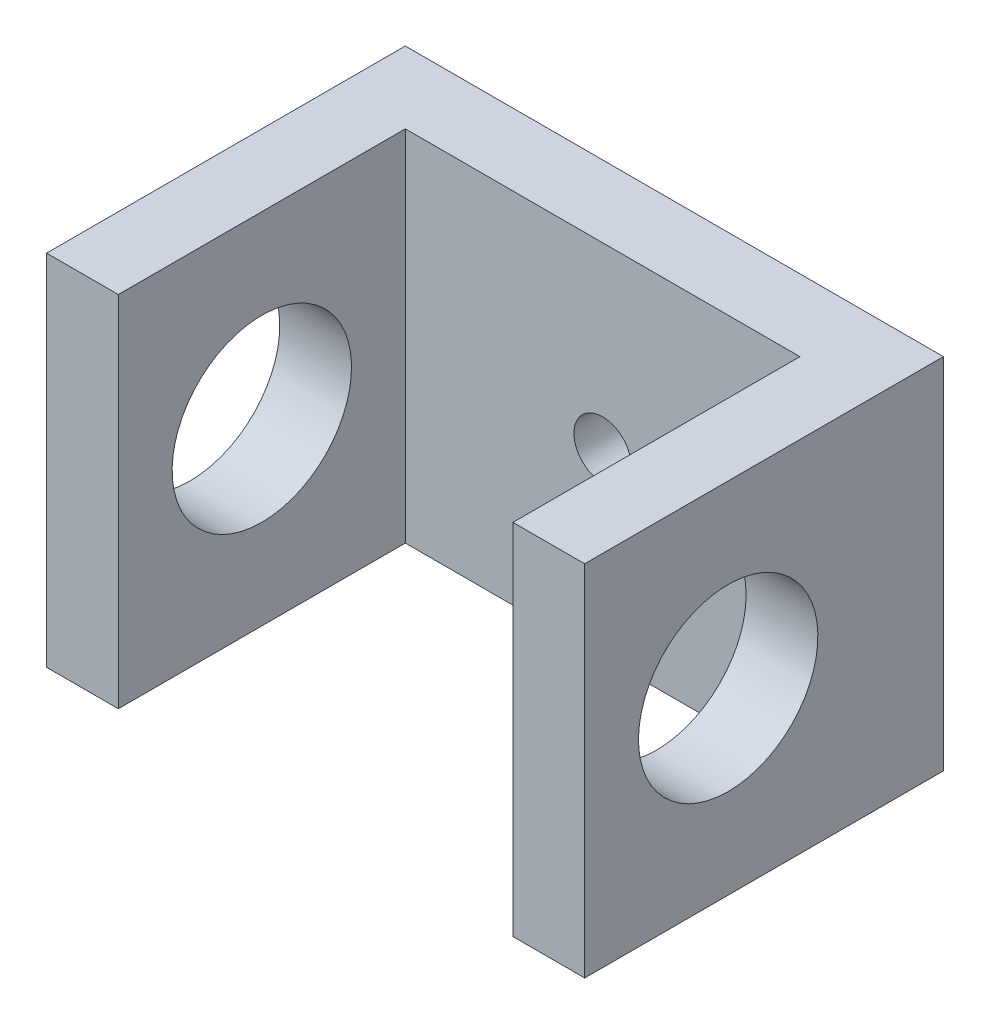
from build123d import *

# Parameters (mm, degrees)
SKETCH1_W           = 15
SKETCH1_H           = 10
BOSS_EXTRUDE1_DEPTH = 2
SKETCH2_W           = 2
SKETCH2_H           = 10
BOSS_EXTRUDE2_DEPTH = 8
SKETCH3_R           = 2.5
CUT_EXTRUDE1_DEPTH  = 19.708286934
SKETCH4_R           = 0.8
CUT_EXTRUDE2_DEPTH  = 13.051970793


with BuildPart() as part:
    # Sketch1 → Boss-Extrude1 (new body)
    with BuildSketch(Plane.XY):
        Rectangle(SKETCH1_W, SKETCH1_H)
    extrude(amount=BOSS_EXTRUDE1_DEPTH)

    # Sketch2 → Boss-Extrude2 (add)
    with BuildSketch(Plane.XY.offset(2)):
        with Locations((-6.5, 0)):
            Rectangle(SKETCH2_W, SKETCH2_H)
        with Locations((6.5, 0)):
            Rectangle(SKETCH2_W, SKETCH2_H)
    extrude(amount=BOSS_EXTRUDE2_DEPTH)

    # Sketch3 → Cut-Extrude1 (cut, through all)
    with BuildSketch(Plane.ZY.offset(7.5)):
        with Locations(Location((6, 0, 0), (0, 0, 270))):
            Circle(SKETCH3_R)
    extrude(amount=-CUT_EXTRUDE1_DEPTH, mode=Mode.SUBTRACT)

    # Sketch4 → Cut-Extrude2 (cut, through all)
    with BuildSketch(Plane.XY.offset(2)):
        Circle(SKETCH4_R)
    extrude(amount=-CUT_EXTRUDE2_DEPTH, mode=Mode.SUBTRACT)


solid = part.part
